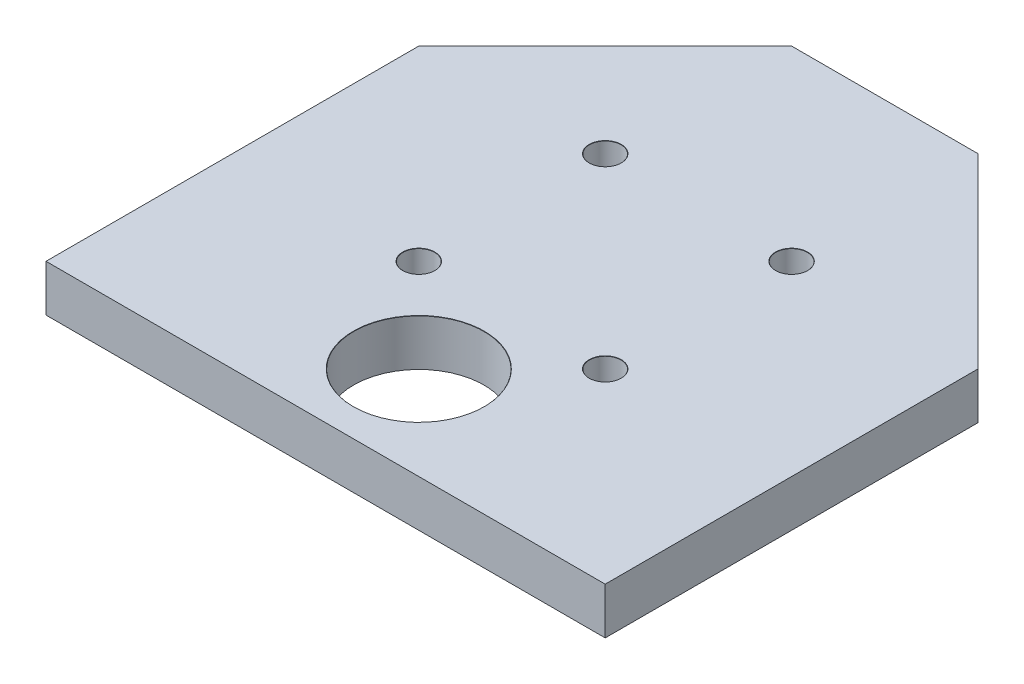
from build123d import *

# Parameters (mm, degrees)
EXTRUDE_1_DEPTH                = 5
HOLE_WIZARD_M3_1_2_D           = 3.4
HOLE_WIZARD_M3_1_2_CSINK_D     = 3.45
HOLE_WIZARD_M3_1_2_CSINK_ANGLE = 90


with BuildPart() as part:
    # 草图1 → 凸台-拉伸1 (new body)
    with BuildSketch(Plane(origin=(0, 0, 0), x_dir=(1, 0, 0), z_dir=(0, 1, 0))):
        Polygon((-10, 30), (-30, 10), (-30, -30), (30, -30), (30, 10), (10, 30), align=None)
    extrude(amount=EXTRUDE_1_DEPTH)

    # 草图8 → Hole Wizard M3 _1 (revolve, cut)
    with BuildSketch(Plane(origin=(-15.656854249, 2.5, -24.343145751), x_dir=(-0.707106781186551, 0, 0.707106781186544), z_dir=(0, 1, 0))):
        Polygon((0, 0), (0, 10.751075774), (1.25, 10), (1.25, 0.025), (1.275, 0), align=None)
    hole_wizard_m3_1 = revolve(axis=Axis((-20.14698231, 2.5, -28.833273811), (0.707106781186544, 0, 0.707106781186551)), mode=Mode.SUBTRACT)

    # 草图10 → M16 螺纹孔的螺纹孔钻头1 (revolve, cut)
    with BuildSketch(Plane(origin=(0, 5, 20), x_dir=(0, 0, 1), z_dir=(1, 0, 0))):
        Polygon((0, 0), (0, 5), (7, 5), (7, 0.025), (7.025, 0), align=None)
    revolve(axis=Axis((0, 11.35, 20), (0, -1, 0)), mode=Mode.SUBTRACT)

    # 镜向2: Hole Wizard M3 _1 across plane
    add(hole_wizard_m3_1.mirror(Plane(origin=(0, 0, 0), x_dir=(0, 0, 1), z_dir=(1, 0, 0))), mode=Mode.SUBTRACT)

    # Hole Wizard M3 _1 2 (through all)
    with Locations(Plane(origin=(-10, 5, -10), x_dir=(0, 0, 1), z_dir=(0, 1, 0))):
        with Locations((0, 0), (0, 20), (20, 20), (20, 0)):
            CounterSinkHole(HOLE_WIZARD_M3_1_2_D / 2, HOLE_WIZARD_M3_1_2_CSINK_D / 2, counter_sink_angle=HOLE_WIZARD_M3_1_2_CSINK_ANGLE)


solid = part.part
